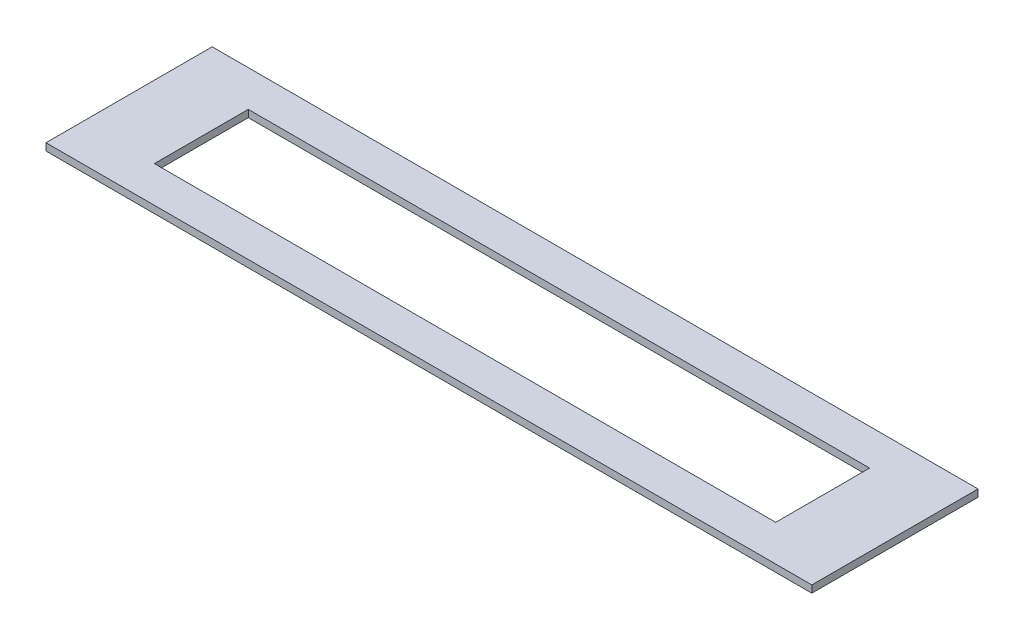
from build123d import *

# Parameters (mm, degrees)
SKETCH1_W           = 530
SKETCH1_H           = 115
SKETCH1_W_2         = 430
SKETCH1_H_2         = 65
BOSS_EXTRUDE1_DEPTH = 5


with BuildPart() as part:
    # Sketch1 → Boss-Extrude1 (new body)
    with BuildSketch(Plane(origin=(0, 0, 0), x_dir=(1, 0, 0), z_dir=(0, 1, 0))):
        with Locations((265, 57.5)):
            Rectangle(SKETCH1_W, SKETCH1_H)
        with Locations((265, 57.5)):
            Rectangle(SKETCH1_W_2, SKETCH1_H_2, mode=Mode.SUBTRACT)
    extrude(amount=BOSS_EXTRUDE1_DEPTH)


solid = part.part
